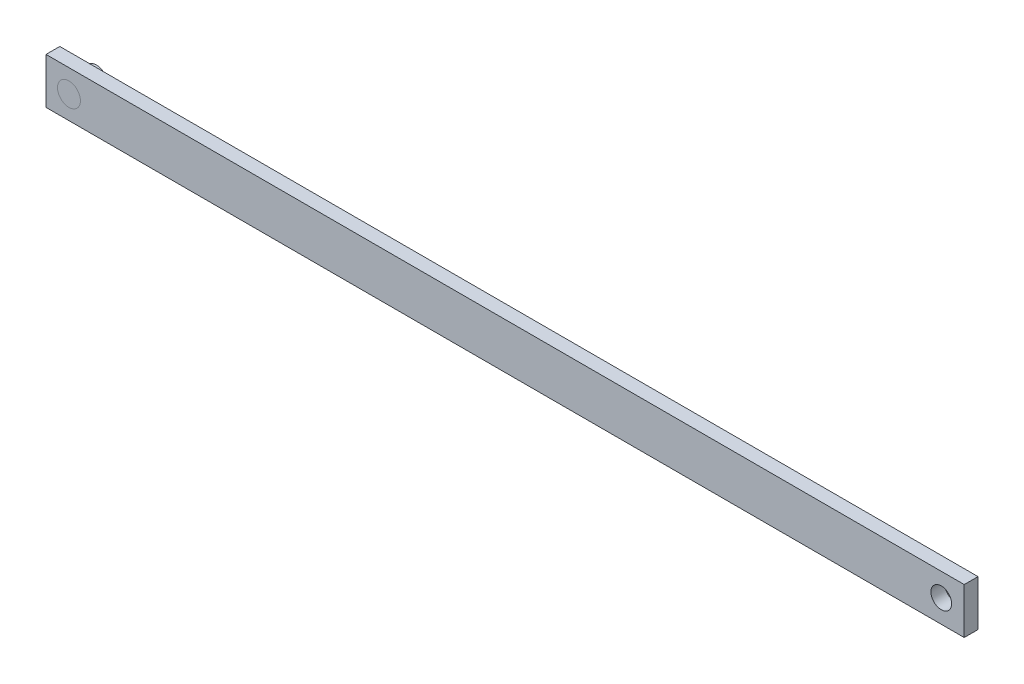
from build123d import *

# Parameters (mm, degrees)
ESQUISSE1_W             = 400
ESQUISSE1_H             = 20
BOSS_EXTRU_1_DEPTH      = 6
ESQUISSE2_R             = 4.5
ESQUISSE2_R_2           = 5
ENL_V_MAT_EXTRU_1_DEPTH = 201.33971149
ESQUISSE3_R             = 5
BOSS_EXTRU_2_DEPTH      = 12


with BuildPart() as part:
    # Esquisse1 → Boss.-Extru.1 (new body)
    with BuildSketch(Plane.XY):
        Rectangle(ESQUISSE1_W, ESQUISSE1_H)
    extrude(amount=BOSS_EXTRU_1_DEPTH)

    # Esquisse2 → Enlèv. mat.-Extru.1 (cut, through all)
    with BuildSketch(Plane.XY.offset(6)):
        with Locations((190, 0)):
            Circle(ESQUISSE2_R)
        with Locations((-190, 0)):
            Circle(ESQUISSE2_R_2)
    extrude(amount=-ENL_V_MAT_EXTRU_1_DEPTH, mode=Mode.SUBTRACT)


with BuildPart() as body_2:
    # Esquisse3 → Boss.-Extru.2 (new body)
    with BuildSketch(Plane.XY.offset(6)):
        with Locations((-190, 0)):
            Circle(ESQUISSE3_R)
    extrude(amount=-BOSS_EXTRU_2_DEPTH)


solid = Compound([part.part, body_2.part])
